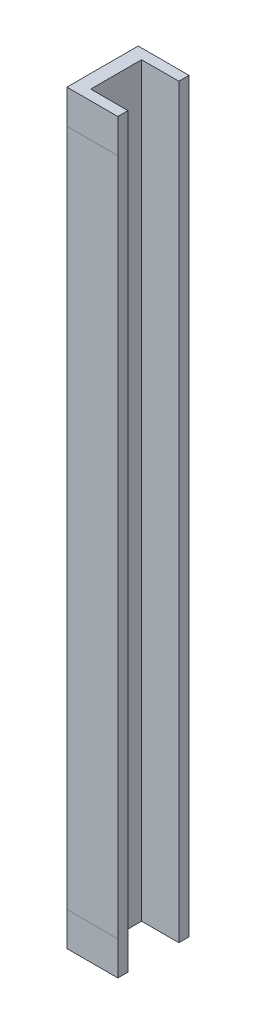
from build123d import *

# Parameters (mm, degrees)
DODANIE_WYCI_GNI_CIE1_DEPTH = 2200


with BuildPart() as part:
    # Szkic1 → Dodanie-wyciągnięcie1 (new body)
    with BuildSketch(Plane(origin=(0, 0, 0), x_dir=(1, 0, 0), z_dir=(0, 1, 0))):
        Polygon((0, 0), (150, 0), (150, 30), (40, 30), (40, 180), (150, 180), (150, 210), (0, 210), align=None)
    extrude(amount=DODANIE_WYCI_GNI_CIE1_DEPTH)


solid = part.part
